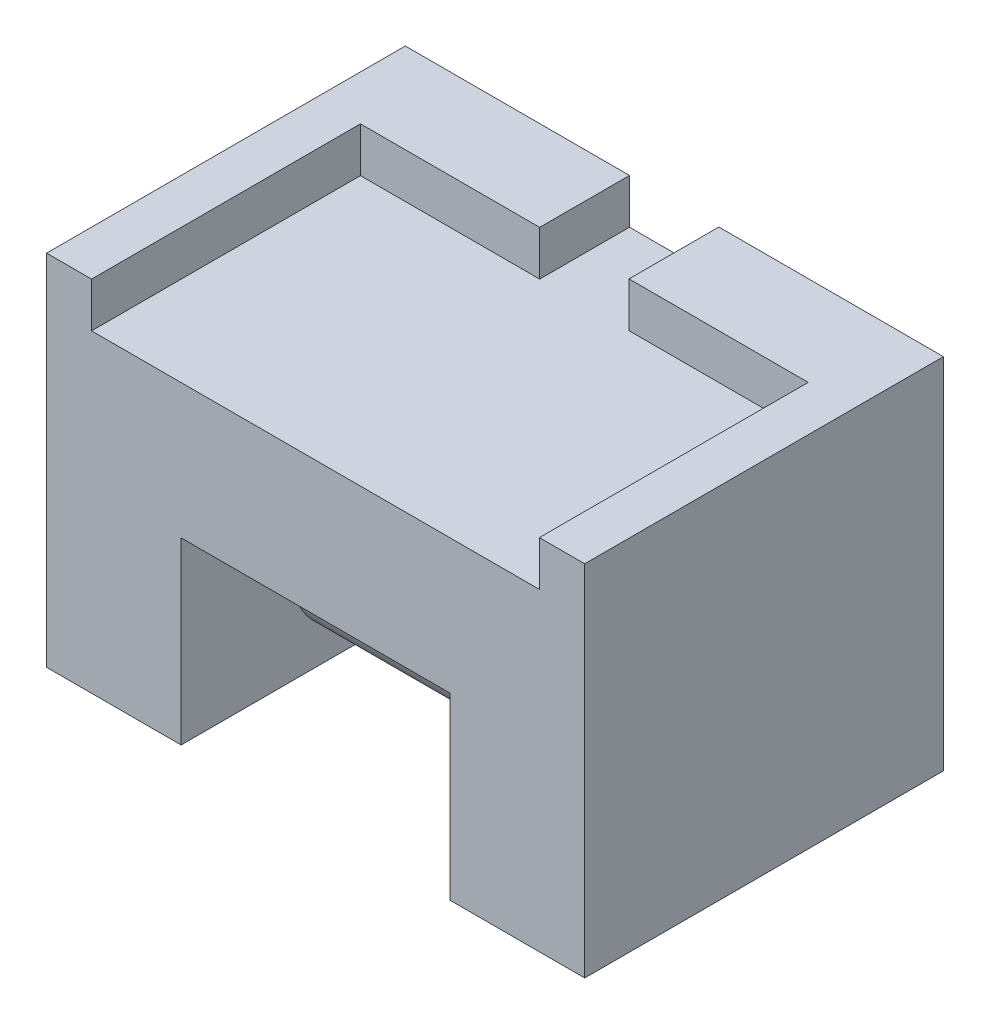
from build123d import *

# Parameters (mm, degrees)
SKETCH2_W           = 76.2
SKETCH2_H           = 25.4
BOSS_EXTRUDE1_DEPTH = 50.8
SKETCH3_W           = 19.05
SKETCH3_H           = 50.8
BOSS_EXTRUDE2_DEPTH = 25.4
SKETCH4_R           = 9.525
BOSS_EXTRUDE3_DEPTH = 50.8
SKETCH7_W           = 12.6492
SKETCH7_H           = 12.7254
CUT_EXTRUDE1_DEPTH  = 6.35


with BuildPart() as part:
    # Sketch2 → Boss-Extrude1 (new body)
    with BuildSketch(Plane.XY):
        with Locations((30.119125683, -4.19863388)):
            Rectangle(SKETCH2_W, SKETCH2_H)
    extrude(amount=BOSS_EXTRUDE1_DEPTH)

    # Sketch3 → Boss-Extrude2 (add)
    with BuildSketch(Plane.XZ.offset(16.89863388)):
        with Locations((1.544125683, 25.4)):
            Rectangle(SKETCH3_W, SKETCH3_H)
        with Locations((58.694125683, 25.4)):
            Rectangle(SKETCH3_W, SKETCH3_H)
    extrude(amount=BOSS_EXTRUDE2_DEPTH)

    # Sketch4 → Boss-Extrude3 (add)
    with BuildSketch(Plane(origin=(11.069125683, 0, 0), x_dir=(0, 0, -1), z_dir=(1, 0, 0))):
        with Locations(Location((-25.4, -29.59863388, 0), (0, 0, 180))):
            Circle(SKETCH4_R)
    extrude(amount=BOSS_EXTRUDE3_DEPTH)

    # Sketch7 → Cut-Extrude1 (cut)
    with BuildSketch(Plane(origin=(0, 8.50136612, 0), x_dir=(1, 0, 0), z_dir=(0, 1, 0))):
        Polygon((-1.610554317, -12.7254), (-1.610554317, -50.8), (61.798005683, -50.8), (61.798005683, -12.7254), (36.418325683, -12.7254), (23.769125683, -12.7254), align=None)
        with Locations((30.093725683, -6.3627)):
            Rectangle(SKETCH7_W, SKETCH7_H)
    extrude(amount=-CUT_EXTRUDE1_DEPTH, mode=Mode.SUBTRACT)


solid = part.part
